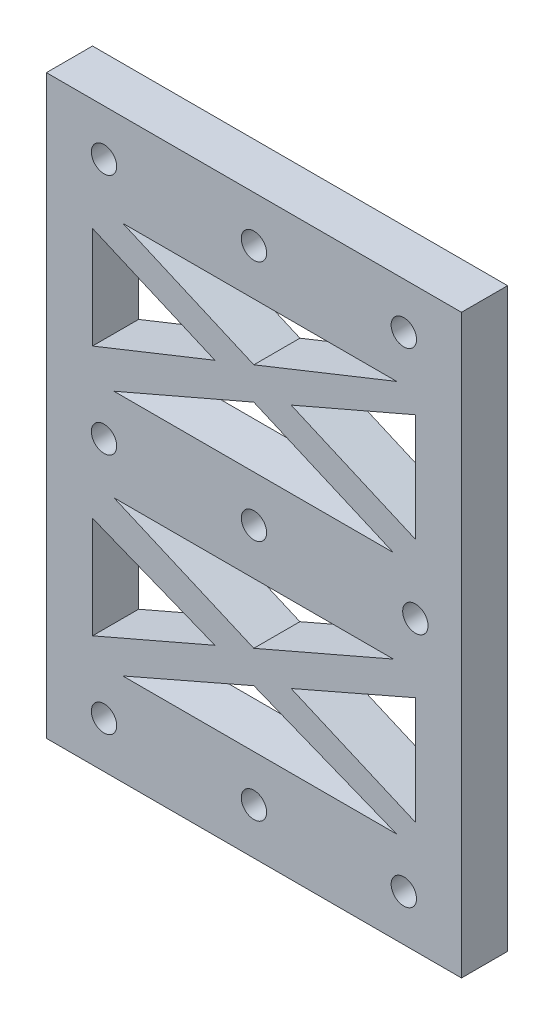
from build123d import *

# Parameters (mm, degrees)
SKETCH_1_W          = 72
SKETCH_1_H          = 100
EXTRUDE_1_DEPTH     = 8
CUT_EXTRUDE_1_REACH = 64.129
SKETCH_2_R          = 2.2
SKETCH_2_W          = 56
SKETCH_2_H          = 26
EXTRUDE_2_DEPTH     = 8


with BuildPart() as part:
    # 草图1 → 凸台-拉伸1 (new body)
    with BuildSketch(Plane.XY):
        Rectangle(SKETCH_1_W, SKETCH_1_H)
    extrude(amount=EXTRUDE_1_DEPTH)

    # 草图2 → 切除-拉伸1 (cut, up to next)
    with BuildSketch(Plane.XY.offset(8), mode=Mode.PRIVATE) as cut_extrude_1_sk1:
        with Locations((-26, -42)):
            Circle(SKETCH_2_R)
    cut_extrude_1_tool1 = extrude(cut_extrude_1_sk1.sketch, amount=-CUT_EXTRUDE_1_REACH, mode=Mode.PRIVATE) & part.part
    # 草图2 → 切除-拉伸1 (cut, up to next)
    with BuildSketch(Plane.XY.offset(8), mode=Mode.PRIVATE) as cut_extrude_1_sk2:
        with Locations((0, -42)):
            Circle(SKETCH_2_R)
    cut_extrude_1_tool2 = extrude(cut_extrude_1_sk2.sketch, amount=-CUT_EXTRUDE_1_REACH, mode=Mode.PRIVATE) & part.part
    # 草图2 → 切除-拉伸1 (cut, up to next)
    with BuildSketch(Plane.XY.offset(8), mode=Mode.PRIVATE) as cut_extrude_1_sk3:
        with Locations((26, -42)):
            Circle(SKETCH_2_R)
    cut_extrude_1_tool3 = extrude(cut_extrude_1_sk3.sketch, amount=-CUT_EXTRUDE_1_REACH, mode=Mode.PRIVATE) & part.part
    # 草图2 → 切除-拉伸1 (cut, up to next)
    with BuildSketch(Plane.XY.offset(8), mode=Mode.PRIVATE) as cut_extrude_1_sk4:
        with Locations((26, 42)):
            Circle(SKETCH_2_R)
    cut_extrude_1_tool4 = extrude(cut_extrude_1_sk4.sketch, amount=-CUT_EXTRUDE_1_REACH, mode=Mode.PRIVATE) & part.part
    # 草图2 → 切除-拉伸1 (cut, up to next)
    with BuildSketch(Plane.XY.offset(8), mode=Mode.PRIVATE) as cut_extrude_1_sk5:
        with Locations((0, 42)):
            Circle(SKETCH_2_R)
    cut_extrude_1_tool5 = extrude(cut_extrude_1_sk5.sketch, amount=-CUT_EXTRUDE_1_REACH, mode=Mode.PRIVATE) & part.part
    # 草图2 → 切除-拉伸1 (cut, up to next)
    with BuildSketch(Plane.XY.offset(8), mode=Mode.PRIVATE) as cut_extrude_1_sk6:
        with Locations((-26, 42)):
            Circle(SKETCH_2_R)
    cut_extrude_1_tool6 = extrude(cut_extrude_1_sk6.sketch, amount=-CUT_EXTRUDE_1_REACH, mode=Mode.PRIVATE) & part.part
    # 草图2 → 切除-拉伸1 (cut, up to next)
    with BuildSketch(Plane.XY.offset(8), mode=Mode.PRIVATE) as cut_extrude_1_sk7:
        with Locations((-26, 0)):
            Circle(SKETCH_2_R)
    cut_extrude_1_tool7 = extrude(cut_extrude_1_sk7.sketch, amount=-CUT_EXTRUDE_1_REACH, mode=Mode.PRIVATE) & part.part
    # 草图2 → 切除-拉伸1 (cut, up to next)
    with BuildSketch(Plane.XY.offset(8), mode=Mode.PRIVATE) as cut_extrude_1_sk8:
        Circle(SKETCH_2_R)
    cut_extrude_1_tool8 = extrude(cut_extrude_1_sk8.sketch, amount=-CUT_EXTRUDE_1_REACH, mode=Mode.PRIVATE) & part.part
    # 草图2 → 切除-拉伸1 (cut, up to next)
    with BuildSketch(Plane.XY.offset(8), mode=Mode.PRIVATE) as cut_extrude_1_sk9:
        with Locations((28, 0)):
            Circle(SKETCH_2_R)
    cut_extrude_1_tool9 = extrude(cut_extrude_1_sk9.sketch, amount=-CUT_EXTRUDE_1_REACH, mode=Mode.PRIVATE) & part.part
    # 草图2 → 切除-拉伸1 (cut, up to next)
    with BuildSketch(Plane.XY.offset(8), mode=Mode.PRIVATE) as cut_extrude_1_sk10:
        with Locations((0, 21)):
            Rectangle(SKETCH_2_W, SKETCH_2_H)
    cut_extrude_1_tool10 = extrude(cut_extrude_1_sk10.sketch, amount=-CUT_EXTRUDE_1_REACH, mode=Mode.PRIVATE) & part.part
    # 草图2 → 切除-拉伸1 (cut, up to next)
    with BuildSketch(Plane.XY.offset(8), mode=Mode.PRIVATE) as cut_extrude_1_sk11:
        with Locations((0, -21)):
            Rectangle(SKETCH_2_W, SKETCH_2_H)
    cut_extrude_1_tool11 = extrude(cut_extrude_1_sk11.sketch, amount=-CUT_EXTRUDE_1_REACH, mode=Mode.PRIVATE) & part.part
    add(cut_extrude_1_tool1.solids().sort_by_distance((-26, -42, 8))[0], mode=Mode.SUBTRACT)
    add(cut_extrude_1_tool2.solids().sort_by_distance((0, -42, 8))[0], mode=Mode.SUBTRACT)
    add(cut_extrude_1_tool3.solids().sort_by_distance((26, -42, 8))[0], mode=Mode.SUBTRACT)
    add(cut_extrude_1_tool4.solids().sort_by_distance((26, 42, 8))[0], mode=Mode.SUBTRACT)
    add(cut_extrude_1_tool5.solids().sort_by_distance((0, 42, 8))[0], mode=Mode.SUBTRACT)
    add(cut_extrude_1_tool6.solids().sort_by_distance((-26, 42, 8))[0], mode=Mode.SUBTRACT)
    add(cut_extrude_1_tool7.solids().sort_by_distance((-26, 0, 8))[0], mode=Mode.SUBTRACT)
    add(cut_extrude_1_tool8.solids().sort_by_distance((0, 0, 8))[0], mode=Mode.SUBTRACT)
    add(cut_extrude_1_tool9.solids().sort_by_distance((28, 0, 8))[0], mode=Mode.SUBTRACT)
    add(cut_extrude_1_tool10.solids().sort_by_distance((0, 21, 8))[0], mode=Mode.SUBTRACT)
    add(cut_extrude_1_tool11.solids().sort_by_distance((0, -21, 8))[0], mode=Mode.SUBTRACT)

    # 草图3 → 凸台-拉伸2 (add)
    with BuildSketch(Plane.XY.offset(8)):
        Polygon((-28, 30.60122868), (-6.768682564, 21.407188314), (-28, 12.93157869), (-28, 8), (-24.288219299, 8), (-0.025829724, 18.487253581), (24.191837476, 8), (28, 8), (28, 11.903155093), (6.450556004, 21.286627452), (28, 30.60122868), (28, 34), (24.776184912, 34), (-0.016552798, 24.102660047), (-22.746110137, 34), (-28, 34), align=None)
        Polygon((-28, -8), (-24.288219299, -8), (-0.025829724, -18.487253581), (24.191837476, -8), (28, -8), (28, -11.903155093), (6.450556004, -21.286627452), (28, -30.60122868), (28, -34), (24.776184912, -34), (-0.016552798, -24.102660047), (-22.746110137, -34), (-28, -34), (-28, -30.60122868), (-6.768682564, -21.407188314), (-28, -12.93157869), align=None)
    extrude(amount=-EXTRUDE_2_DEPTH)


solid = part.part
